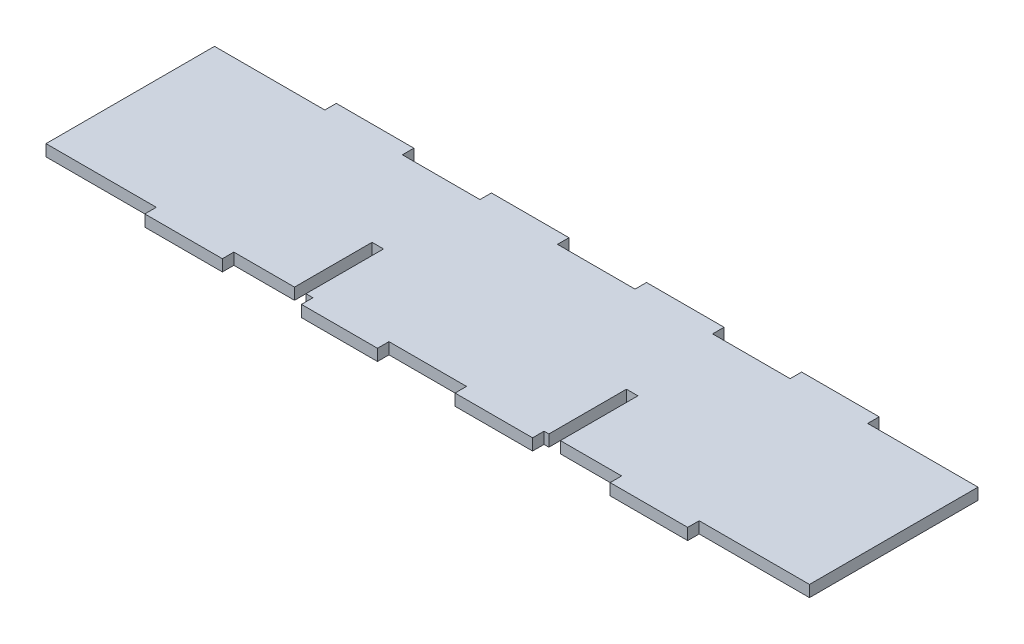
from build123d import *

# Parameters (mm, degrees)
SKETCH1_W           = 500
SKETCH1_H           = 400
BOSS_EXTRUDE1_DEPTH = 6
SKETCH10_W          = 500
SKETCH10_H          = 400
CUT_EXTRUDE4_DEPTH  = 321.21242949


with BuildPart() as part:
    # Sketch1 → Boss-Extrude1 (new body)
    with BuildSketch(Plane(origin=(0, 0, 0), x_dir=(1, 0, 0), z_dir=(0, 1, 0))):
        Rectangle(SKETCH1_W, SKETCH1_H)
    extrude(amount=BOSS_EXTRUDE1_DEPTH)

    # Sketch10 → Cut-Extrude4 (cut, through all)
    with BuildSketch(Plane(origin=(0, 6, 0), x_dir=(1, 0, 0), z_dir=(0, 1, 0))):
        Rectangle(SKETCH10_W, SKETCH10_H)
        with BuildLine():
            Line((-56.474136069, -35.255089794), (-60.116609751, -35.255074272))
            Line((-60.116609751, -35.255074272), (-60.116609751, 5.244926844))
            Line((-60.116609751, 5.244926844), (-66.116640434, 5.244926844))
            Line((-66.116640434, 5.244926844), (-66.116640434, -35.255074272))
            Line((-66.116640434, -35.255074272), (-66.151890674, -35.25504815))
            Line((-66.151890674, -35.25504815), (-97.779213654, -35.254912055))
            Line((-97.779213654, -35.254912055), (-97.779213654, -41.25491222))
            Line((-97.779213654, -41.25491222), (-138.27921477, -41.25491222))
            Line((-138.27921477, -41.25491222), (-138.27921477, -35.254912055))
            Line((-138.27921477, -35.254912055), (-195.884196827, -35.254912055))
            Line((-195.884196827, -35.254912055), (-195.884196827, -11.505116755))
            Line((-195.884196827, -11.505116755), (-195.884196827, -11.5049114))
            Line((-195.884196827, -11.5049114), (-195.884196827, 28.994884362))
            Line((-195.884196827, 28.994884362), (-195.884196827, 28.995089716))
            Line((-195.884196827, 28.995089716), (-195.884196827, 52.745090371))
            Line((-195.884196827, 52.745090371), (-178.779215887, 52.745090371))
            Line((-178.779215887, 52.745090371), (-138.27921477, 52.745090371))
            Line((-138.27921477, 52.745090371), (-138.27921477, 58.745090537))
            Line((-138.27921477, 58.745090537), (-97.779213654, 58.745090537))
            Line((-97.779213654, 58.745090537), (-97.779213654, 52.745090371))
            Line((-97.779213654, 52.745090371), (-57.279212537, 52.745090371))
            Line((-57.279212537, 52.745090371), (-57.279212537, 58.745090537))
            Line((-57.279212537, 58.745090537), (-16.779211421, 58.745090537))
            Line((-16.779211421, 58.745090537), (-16.779211421, 52.745090371))
            Line((-16.779211421, 52.745090371), (23.720789695, 52.745090371))
            Line((23.720789695, 52.745090371), (23.720789695, 58.745090537))
            Line((23.720789695, 58.745090537), (64.220790812, 58.745090537))
            Line((64.220790812, 58.745090537), (64.220790812, 52.745090371))
            Line((64.220790812, 52.745090371), (104.720791928, 52.745090371))
            Line((104.720791928, 52.745090371), (104.720791928, 58.745090537))
            Line((104.720791928, 58.745090537), (145.220793045, 58.745090537))
            Line((145.220793045, 58.745090537), (145.220793045, 52.745090371))
            Line((145.220793045, 52.745090371), (202.825775101, 52.745090371))
            Line((202.825775101, 52.745090371), (202.825775101, 28.995089716))
            Line((202.825775101, 28.995089716), (202.825775101, -11.5049114))
            Line((202.825775101, -11.5049114), (202.825775101, -35.254912055))
            Line((202.825775101, -35.254912055), (185.720794161, -35.254912055))
            Line((185.720794161, -35.254912055), (145.220793045, -35.254912055))
            Line((145.220793045, -35.254912055), (145.220793045, -41.25491222))
            Line((145.220793045, -41.25491222), (104.720791928, -41.25491222))
            Line((104.720791928, -41.25491222), (104.720791928, -35.254912055))
            Line((104.720791928, -35.254912055), (72.732455527, -35.254912055))
            add(Edge.make_bspline(
                [(72.732455674, 5.244926844), (72.732455674, -35.255074272), (72.732455527, -35.254912055)],
                knots=[11, 11, 11, 12, 12, 12], degree=2))
            Line((72.732455674, 5.244926844), (66.732424991, 5.244926844))
            add(Edge.make_bspline(
                [(66.732427246, -35.254912055), (66.732424991, -35.255074272), (66.732424991, 5.244926844)],
                knots=[9, 9, 9, 10, 10, 10], degree=2))
            Line((66.732427246, -35.254912055), (64.220790812, -35.254912055))
            Line((64.220790812, -35.254912055), (64.220790812, -41.25491222))
            Line((64.220790812, -41.25491222), (23.720789695, -41.25491222))
            Line((23.720789695, -41.25491222), (23.720789695, -35.254912055))
            Line((23.720789695, -35.254912055), (-16.779211421, -35.254912055))
            Line((-16.779211421, -35.254912055), (-16.779211421, -41.25491222))
            Line((-16.779211421, -41.25491222), (-56.474136069, -41.25508996))
            Line((-56.474136069, -41.25508996), (-56.474136069, -35.255089794))
        make_face(mode=Mode.SUBTRACT)
    extrude(amount=-CUT_EXTRUDE4_DEPTH, mode=Mode.SUBTRACT)


solid = part.part
